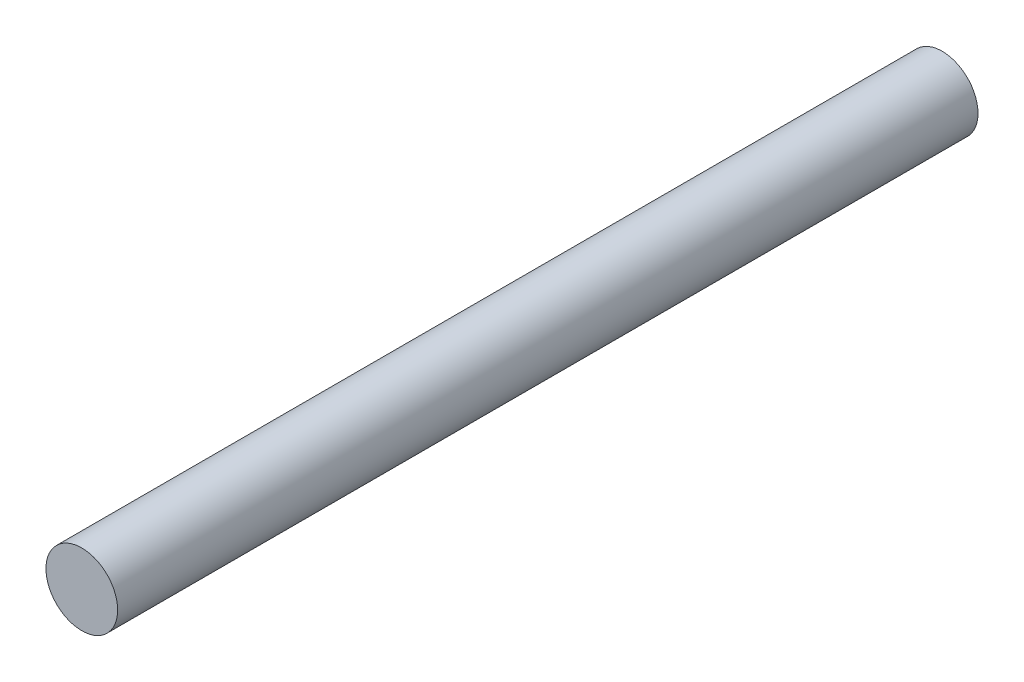
from build123d import *

# Parameters (mm, degrees)
CROQUIS1_R              = 10
SALIENTE_EXTRUIR1_DEPTH = 240


with BuildPart() as part:
    # Croquis1 → Saliente-Extruir1 (new body)
    with BuildSketch(Plane.XY):
        Circle(CROQUIS1_R)
    extrude(amount=SALIENTE_EXTRUIR1_DEPTH)


solid = part.part
